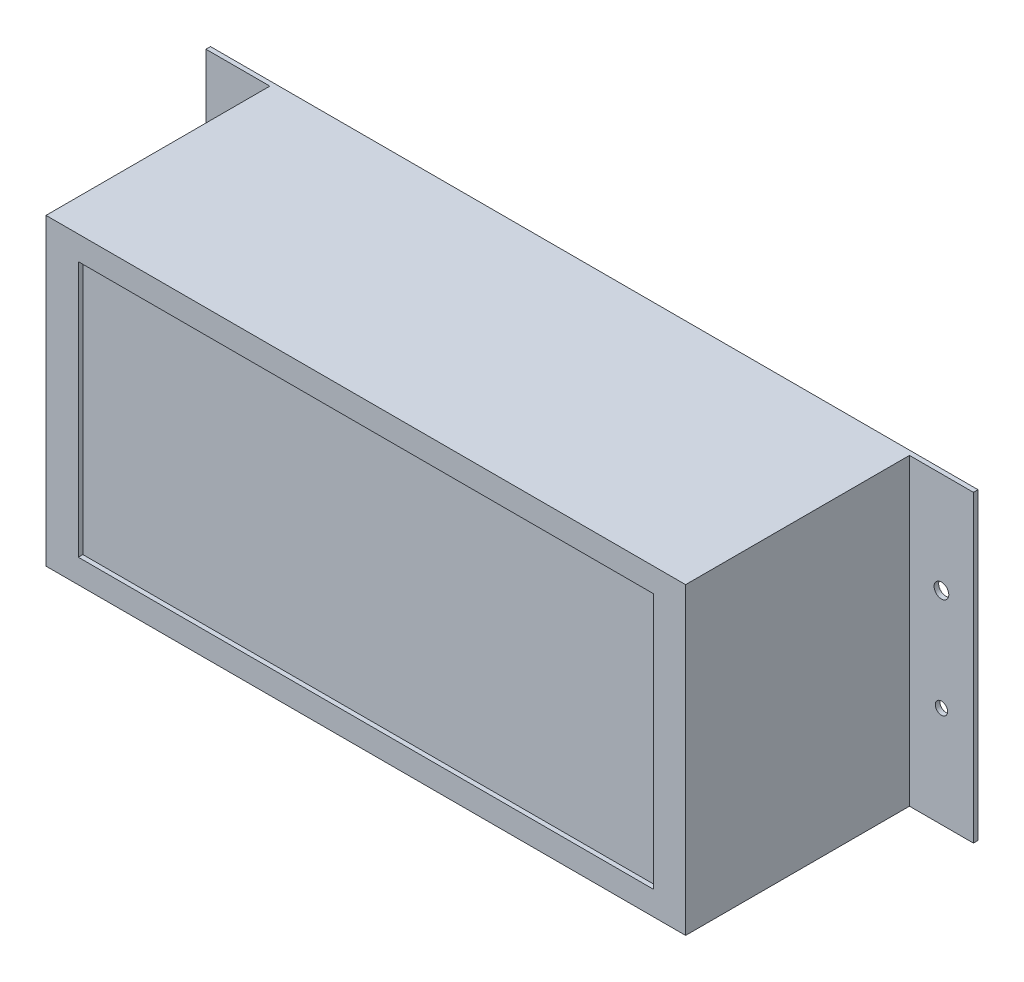
from build123d import *

# Parameters (mm, degrees)
CROQUIS1_W              = 280
CROQUIS1_H              = 133
SALIENTE_EXTRUIR1_DEPTH = 100
CROQUIS2_W              = 28
CROQUIS2_H              = 133
CROQUIS2_R              = 3.219169786
CROQUIS2_R_2            = 2.685008238
SALIENTE_EXTRUIR2_DEPTH = 2
CROQUIS5_W              = 251.717283082
CROQUIS5_H              = 112.065913702
CORTAR_EXTRUIR5_DEPTH   = 2
SALIENTE_EXTRUIR3_DEPTH = 2
CROQUIS8_W              = 280
CROQUIS8_H              = 113
CORTAR_EXTRUIR8_DEPTH   = 1


with BuildPart() as part:
    # Croquis1 → Saliente-Extruir1 (new body)
    with BuildSketch(Plane.XY):
        Rectangle(CROQUIS1_W, CROQUIS1_H)
    extrude(amount=SALIENTE_EXTRUIR1_DEPTH)

    # Croquis2 → Saliente-Extruir2 (add)
    # profile 1 of 2: a face of its own
    with BuildSketch(Plane(origin=(0, 0, 0), x_dir=(-1, 0, 0), z_dir=(0, 0, -1))):
        with Locations((-154, 0)):
            Rectangle(CROQUIS2_W, CROQUIS2_H)
        with Locations((-154, 22.27)):
            Circle(CROQUIS2_R, mode=Mode.SUBTRACT)
        with Locations((-154, -22.32)):
            Circle(CROQUIS2_R_2, mode=Mode.SUBTRACT)
    # profile 2 of 2: a face of its own
    with BuildSketch(Plane(origin=(0, 0, 0), x_dir=(-1, 0, 0), z_dir=(0, 0, -1))):
        with Locations((154, 0)):
            Rectangle(CROQUIS2_W, CROQUIS2_H)
        with Locations(Location((154, -22.32, 0), (0, 0, 180))):
            Circle(CROQUIS2_R_2, mode=Mode.SUBTRACT)
        with Locations(Location((154, 22.27, 0), (0, 0, 180))):
            Circle(CROQUIS2_R, mode=Mode.SUBTRACT)
    extrude(amount=-SALIENTE_EXTRUIR2_DEPTH)

    # Croquis5 → Cortar-Extruir5 (cut)
    with BuildSketch(Plane.XY.offset(100)):
        Rectangle(CROQUIS5_W, CROQUIS5_H)
    extrude(amount=-CORTAR_EXTRUIR5_DEPTH, mode=Mode.SUBTRACT)

    # Croquis6 → Saliente-Extruir3 (add)
    # profile 1 of 5: a face of its own
    with BuildSketch(Plane.XZ.offset(66.5)):
        with BuildLine():
            Line((69.930951795, 35.067554065), (73.153441111, 38.385446026))
            add(Edge.make_bspline(
                [(73.153441111, 38.385446026), (73.431442393, 38.063141885), (73.967396138, 37.441777445), (74.818171206, 36.61211083), (75.665378537, 35.909558439), (76.504549719, 35.331478038), (77.337250779, 34.87652343), (78.170591397, 34.555193776), (79.002284769, 34.353464182), (79.558499221, 34.327622611), (79.831626207, 34.314933205)],
                knots=[0, 0, 0, 0, 1.265880991, 2.440469525, 3.530740057, 4.536711111, 5.468008477, 6.34654737, 7.188078389, 8, 8, 8, 8], degree=3))
            add(Edge.make_bspline(
                [(79.831626207, 34.314933205), (80.166222801, 34.331385066), (80.824661544, 34.363760001), (81.767418959, 34.679081533), (82.631925953, 35.176872503), (83.396994708, 35.855596851), (84.035764688, 36.659911985), (84.514536587, 37.551668499), (84.801034986, 38.516562484), (84.837613321, 39.182115791), (84.85616547, 39.519677463)],
                knots=[0, 0, 0, 0, 0.999905305, 1.967672129, 2.944835807, 3.972828834, 5.013019963, 6.007753697, 6.989553527, 8, 8, 8, 8], degree=3))
            add(Edge.make_bspline(
                [(84.85616547, 39.519677463), (84.839371046, 39.825264321), (84.805829543, 40.435576591), (84.545076178, 41.335886151), (84.129815325, 42.213653276), (83.741706435, 42.75133055), (83.541729038, 43.028374712)],
                knots=[0, 0, 0, 0, 0.960159726, 1.917612774, 2.927026955, 4, 4, 4, 4], degree=3))
            add(Edge.make_bspline(
                [(83.541729038, 43.028374712), (83.42070926, 43.17565306), (83.161574277, 43.491014505), (82.69155011, 43.93981677), (82.134758735, 44.409101119), (81.485913926, 44.895683782), (80.743711514, 45.400074486), (79.919028431, 45.930841302), (79.001672203, 46.472447385), (78.355617997, 46.828536443), (78.018975967, 47.014085182)],
                knots=[0, 0, 0, 0, 0.667332049, 1.428932371, 2.272176193, 3.217953793, 4.268659351, 5.415594948, 6.6533338, 8, 8, 8, 8], degree=3))
            add(Edge.make_bspline(
                [(78.018975967, 47.014085182), (77.607458959, 47.244476669), (76.812543604, 47.689517158), (75.684251107, 48.381908705), (74.654216022, 49.065470471), (73.736660447, 49.755831292), (72.910069493, 50.424593515), (72.187725658, 51.090244696), (71.567391702, 51.754544222), (71.220426205, 52.219293712), (71.054582938, 52.441435609)],
                knots=[0, 0, 0, 0, 1.271974443, 2.457035787, 3.569878245, 4.604907449, 5.553098313, 6.436573686, 7.252710343, 8, 8, 8, 8], degree=3))
            add(Edge.make_bspline(
                [(71.054582938, 52.441435609), (70.777469881, 52.889327407), (70.224902616, 53.782429845), (69.676811744, 55.261275251), (69.316545392, 56.812643958), (69.274146731, 57.877278299), (69.252532991, 58.420001314)],
                knots=[0, 0, 0, 0, 0.995678878, 1.985397446, 2.973007791, 4, 4, 4, 4], degree=3))
            add(Edge.make_bspline(
                [(69.252532991, 58.420001314), (69.263387571, 58.802058445), (69.284777707, 59.554943758), (69.43416796, 60.663528547), (69.68924029, 61.724513847), (70.042550869, 62.744312691), (70.496469182, 63.720177517), (71.062301604, 64.645197893), (71.729930658, 65.519190074), (72.473352709, 66.353615), (73.303603217, 67.111776884), (74.199908569, 67.768294079), (75.135229654, 68.339447467), (76.130126058, 68.793638037), (77.172097942, 69.158656555), (78.26707811, 69.410267752), (79.410461009, 69.561130905), (80.188037891, 69.58205119), (80.584247067, 69.592710983)],
                knots=[0, 0, 0, 0, 1.032810722, 2.035266353, 3.017676364, 3.978389067, 4.948507077, 5.921677479, 6.903715858, 7.918386526, 8.939467451, 9.936812204, 10.918153393, 11.89693397, 12.887853058, 13.89815236, 14.929017384, 16, 16, 16, 16], degree=3))
            add(Edge.make_bspline(
                [(80.584247067, 69.592710983), (81.118991613, 69.577770278), (82.181050474, 69.548096469), (83.751372484, 69.26729927), (85.289053759, 68.835415133), (86.772000477, 68.219667024), (88.177558236, 67.462661169), (89.471172106, 66.56700031), (90.639382911, 65.537418905), (91.30669664, 64.749916864), (91.640353504, 64.356165844)],
                knots=[0, 0, 0, 0, 1.014105853, 2.01412079, 3.018242674, 4.040740662, 5.055023907, 6.042888753, 7.021444376, 8, 8, 8, 8], degree=3))
            Line((91.640353504, 64.356165844), (88.492066245, 60.773266538))
            add(Edge.make_bspline(
                [(88.492066245, 60.773266538), (88.193126191, 61.09613024), (87.613585697, 61.722050344), (86.686769681, 62.555477876), (85.743652546, 63.253997094), (84.793651927, 63.838248723), (83.822705263, 64.288424461), (82.836253714, 64.604693678), (81.836303732, 64.807957061), (81.164683345, 64.831819186), (80.828053825, 64.843779359)],
                knots=[0, 0, 0, 0, 1.179806542, 2.287233372, 3.337373186, 4.324005949, 5.273901747, 6.200048787, 7.097828587, 8, 8, 8, 8], degree=3))
            add(Edge.make_bspline(
                [(80.828053825, 64.843779359), (80.369679048, 64.823051946), (79.474091624, 64.782554059), (78.191287124, 64.414928756), (77.007060275, 63.838342924), (75.97793191, 63.0210043), (75.107023829, 62.070091103), (74.463687256, 61.002860793), (74.073871619, 59.838391047), (74.02581407, 59.030661517), (74.001464615, 58.621406896)],
                knots=[0, 0, 0, 0, 1.072236613, 2.094970478, 3.102399718, 4.141104368, 5.155589565, 6.110053346, 7.042415349, 8, 8, 8, 8], degree=3))
            add(Edge.make_bspline(
                [(74.001464615, 58.621406896), (74.01738128, 58.283956432), (74.048644905, 57.621133851), (74.309482211, 56.659500305), (74.703996697, 55.742090771), (75.103045019, 55.204818523), (75.305300753, 54.932504653)],
                knots=[0, 0, 0, 0, 1.014054094, 1.991812201, 2.982159616, 4, 4, 4, 4], degree=3))
            add(Edge.make_bspline(
                [(75.305300753, 54.932504653), (75.426565468, 54.795861122), (75.690723813, 54.498202162), (76.175883104, 54.069176396), (76.75216789, 53.603792256), (77.445174239, 53.130203184), (78.219937831, 52.605559948), (79.117839004, 52.085283002), (80.104076893, 51.517849386), (80.802286332, 51.142829391), (81.167263226, 50.946794183)],
                knots=[0, 0, 0, 0, 0.615029206, 1.339755737, 2.178261527, 3.109653826, 4.166232585, 5.329982127, 6.604294388, 8, 8, 8, 8], degree=3))
            add(Edge.make_bspline(
                [(81.167263226, 50.946794183), (81.561063617, 50.726976359), (82.324768252, 50.300679446), (83.406495151, 49.636710137), (84.382389673, 48.961383484), (85.275934074, 48.312582224), (86.064558803, 47.656098905), (86.745157069, 46.991204746), (87.344524737, 46.34471448), (87.6763487, 45.88664821), (87.834848029, 45.667847869)],
                knots=[0, 0, 0, 0, 1.262093308, 2.447601706, 3.550203992, 4.582594899, 5.537233252, 6.418365656, 7.244515135, 8, 8, 8, 8], degree=3))
            add(Edge.make_bspline(
                [(87.834848029, 45.667847869), (88.108568161, 45.227056277), (88.654357914, 44.348131034), (89.193712397, 42.879277801), (89.554221464, 41.32872995), (89.587922078, 40.256784024), (89.605097094, 39.710482751)],
                knots=[0, 0, 0, 0, 0.984940175, 1.963941237, 2.962352981, 4, 4, 4, 4], degree=3))
            add(Edge.make_bspline(
                [(89.605097094, 39.710482751), (89.597030113, 39.353285337), (89.581241888, 38.65419939), (89.454953384, 37.627084017), (89.225759624, 36.650977105), (88.934936006, 35.709312403), (88.539187279, 34.819401562), (88.059402709, 33.971990327), (87.484874398, 33.180811356), (86.83839996, 32.440440726), (86.135969753, 31.760499032), (85.365896696, 31.178866528), (84.560270476, 30.674454643), (83.701468161, 30.270467743), (82.800459046, 29.949405534), (81.850224845, 29.731934867), (80.857336317, 29.585653161), (80.178453483, 29.572646445), (79.831626207, 29.566001581)],
                knots=[0, 0, 0, 0, 1.087410352, 2.12821612, 3.143409386, 4.13688077, 5.124334423, 6.102425883, 7.096654197, 8.095527921, 9.09231389, 10.067027194, 11.028349958, 11.981147348, 12.950860869, 13.934615631, 14.944837612, 16, 16, 16, 16], degree=3))
            add(Edge.make_bspline(
                [(79.831626207, 29.566001581), (79.420487929, 29.582659075), (78.590498846, 29.616286539), (77.34569004, 29.884589403), (76.10412504, 30.321526808), (74.864531347, 30.93916471), (73.621627752, 31.716009213), (72.380985413, 32.672198922), (71.122447741, 33.780743135), (70.336991232, 34.629033072), (69.930951795, 35.067554065)],
                knots=[0, 0, 0, 0, 0.845753203, 1.707371858, 2.609134499, 3.549244224, 4.552329203, 5.621587647, 6.770486714, 8, 8, 8, 8], degree=3))
        make_face()
    # profile 2 of 5: a face of its own
    with BuildSketch(Plane.XZ.offset(66.5)):
        with BuildLine():
            Line((28.017390096, 56.702753718), (23.798473162, 58.918215123))
            add(Edge.make_bspline(
                [(23.798473162, 58.918215123), (24.134894122, 59.51437052), (24.789436084, 60.67425284), (25.909649487, 62.26868343), (27.096134829, 63.689601548), (28.372470958, 64.93033668), (29.722646607, 66.020035737), (31.166768654, 66.953747188), (32.680807799, 67.764428356), (34.286724753, 68.425177732), (35.982987247, 68.945259545), (37.780045253, 69.32917633), (39.686214617, 69.551851349), (40.991563529, 69.578874012), (41.659968221, 69.592710983)],
                knots=[0, 0, 0, 0, 1.120547187, 2.180141081, 3.186367408, 4.148075574, 5.090720713, 6.023293347, 6.960451315, 7.899733127, 8.862572377, 9.862522039, 10.90550313, 12, 12, 12, 12], degree=3))
            add(Edge.make_bspline(
                [(41.659968221, 69.592710983), (42.402948115, 69.575366783), (43.852286645, 69.541533273), (45.96199479, 69.24984961), (47.948326246, 68.774017428), (49.811170666, 68.109300641), (51.545961321, 67.241053009), (53.156163685, 66.183336671), (54.650179626, 64.941558535), (55.981178182, 63.505063682), (57.178690138, 61.967494541), (58.23799864, 60.366391113), (59.113356681, 58.702428534), (59.860509414, 57.000870119), (60.413336098, 55.239069736), (60.826072558, 53.432549741), (61.057330888, 51.574694645), (61.093353927, 50.318436833), (61.11150735, 49.68535922)],
                knots=[0, 0, 0, 0, 1.145213001, 2.233978795, 3.276616913, 4.289988888, 5.2768102, 6.260573508, 7.254647871, 8.264498533, 9.273731702, 10.25749501, 11.220258744, 12.169609138, 13.119022067, 14.062790212, 15.023763961, 16, 16, 16, 16], degree=3))
            add(Edge.make_bspline(
                [(61.11150735, 49.68535922), (61.095494142, 49.091258808), (61.063758078, 47.913830247), (60.863721173, 46.17112499), (60.509205314, 44.477361481), (60.02272994, 42.831132328), (59.39451467, 41.235193873), (58.625979927, 39.688574816), (57.715928501, 38.192920916), (57.013305934, 37.249444966), (56.659383953, 36.774201368)],
                knots=[0, 0, 0, 0, 1.024358464, 2.0301432, 3.019427413, 4.004406732, 4.986367066, 5.972626655, 6.978780325, 8, 8, 8, 8], degree=3))
            add(Edge.make_bspline(
                [(56.659383953, 36.774201368), (56.180820448, 36.200710809), (55.240390334, 35.073738558), (53.63328455, 33.606437654), (51.91652002, 32.351287162), (50.072828148, 31.327332909), (48.105314532, 30.539750194), (46.024127455, 29.979553025), (43.823514572, 29.630972758), (42.314970366, 29.587987906), (41.543364989, 29.566001581)],
                knots=[0, 0, 0, 0, 1.030811313, 2.025658015, 2.997072178, 3.962767568, 4.930766827, 5.917075773, 6.934604948, 8, 8, 8, 8], degree=3))
            add(Edge.make_bspline(
                [(41.543364989, 29.566001581), (40.750361552, 29.586370979), (39.194669575, 29.626331094), (36.926971016, 30.000106482), (34.777013624, 30.585648083), (32.762539902, 31.438754398), (30.852509773, 32.496237945), (29.09088237, 33.832847633), (27.429299872, 35.379933614), (26.463164233, 36.570948782), (25.971533392, 37.177012532)],
                knots=[0, 0, 0, 0, 1.056389096, 2.072394598, 3.055233004, 4.020130009, 4.981825462, 5.957811105, 6.960805292, 8, 8, 8, 8], degree=3))
            add(Edge.make_bspline(
                [(25.971533392, 37.177012532), (25.636995158, 37.633661917), (24.970145477, 38.543921093), (24.13486194, 40.028175492), (23.409791802, 41.581061859), (22.830233939, 43.227681827), (22.360946242, 44.948525479), (22.02142053, 46.755894905), (21.82230844, 48.649251898), (21.783169801, 49.939308154), (21.763216752, 50.596984487)],
                knots=[0, 0, 0, 0, 0.94817472, 1.890038105, 2.849395472, 3.817997239, 4.812318967, 5.836947057, 6.897266129, 8, 8, 8, 8], degree=3))
            Line((21.763216752, 50.596984487), (56.362575726, 50.596984487))
            add(Edge.make_bspline(
                [(56.362575726, 50.596984487), (56.339276239, 51.106493106), (56.293458736, 52.108421255), (56.080365402, 53.574673617), (55.742846607, 54.97073979), (55.27368568, 56.290671471), (54.685406286, 57.538802442), (53.987429506, 58.723734671), (53.149636056, 59.827472718), (52.216721362, 60.86431963), (51.177793282, 61.78732907), (50.085191019, 62.614105748), (48.924573936, 63.303226469), (47.707642063, 63.871008926), (46.428084315, 64.308012346), (45.087700078, 64.60894775), (43.690659036, 64.809987745), (42.738384324, 64.832379696), (42.253584674, 64.843779359)],
                knots=[0, 0, 0, 0, 1.094405546, 2.152104367, 3.174987145, 4.173015398, 5.153654967, 6.133208507, 7.119289451, 8.123438607, 9.122504012, 10.097966803, 11.060604936, 12.014205423, 12.976096155, 13.956823727, 14.959826266, 16, 16, 16, 16], degree=3))
            add(Edge.make_bspline(
                [(42.253584674, 64.843779359), (41.779552408, 64.834724145), (40.838981458, 64.816756862), (39.435384929, 64.636907866), (38.051295555, 64.356595127), (36.704660775, 63.949863034), (35.417046458, 63.468842397), (34.214595009, 62.906416299), (33.108597662, 62.27249209), (32.076868208, 61.540881921), (31.081577394, 60.652312387), (30.091089209, 59.541371081), (29.038550658, 58.219633199), (28.370586031, 57.227407417), (28.017390096, 56.702753718)],
                knots=[0, 0, 0, 0, 0.991026944, 1.966387566, 2.954903586, 3.941705208, 4.905318989, 5.827751054, 6.715113263, 7.568237245, 8.468614997, 9.499196909, 10.677664282, 12, 12, 12, 12], degree=3))
        make_face()
        with BuildLine():
            add(Edge.make_bspline(
                [(26.512148376, 45.848052863), (26.684967127, 45.217684682), (27.016722984, 44.007582566), (27.727718091, 42.336388861), (28.491314545, 40.834042367), (29.429032058, 39.538532524), (30.490241643, 38.394078701), (31.719801753, 37.399978682), (33.077091545, 36.488132027), (34.586786455, 35.727993967), (36.190537602, 35.103563095), (37.855047875, 34.644357991), (39.566466638, 34.374436061), (40.719145416, 34.334860727), (41.299558232, 34.314933205)],
                knots=[0, 0, 0, 0, 1.154958961, 2.217145986, 3.207012531, 4.129872728, 5.036522214, 5.960144231, 6.920619777, 7.92424629, 8.943461387, 9.961007416, 10.973298156, 12, 12, 12, 12], degree=3))
            add(Edge.make_bspline(
                [(41.299558232, 34.314933205), (41.773554687, 34.324112804), (42.710546028, 34.34225894), (44.090601775, 34.516663087), (45.421779568, 34.800627879), (46.697697793, 35.206918967), (47.92123849, 35.717805401), (49.098015423, 36.332653333), (50.213864346, 37.080763557), (50.911427838, 37.651765538), (51.263834407, 37.940233686)],
                knots=[0, 0, 0, 0, 1.04879286, 2.073242986, 3.073461291, 4.057960153, 5.032623303, 6.005244481, 6.992256684, 8, 8, 8, 8], degree=3))
            add(Edge.make_bspline(
                [(51.263834407, 37.940233686), (51.516260487, 38.168421376), (52.027109351, 38.630217648), (52.708973675, 39.426295505), (53.366703499, 40.285216902), (53.951192286, 41.244474551), (54.506662111, 42.27625102), (55.012839141, 43.388074927), (55.473078737, 44.584639308), (55.73143911, 45.41885865), (55.864361918, 45.848052863)],
                knots=[0, 0, 0, 0, 0.879905587, 1.780714457, 2.708106151, 3.677566983, 4.684151534, 5.740052498, 6.837288539, 8, 8, 8, 8], degree=3))
            Line((55.864361918, 45.848052863), (26.512148376, 45.848052863))
        make_face(mode=Mode.SUBTRACT)
    # profile 3 of 5: a face of its own
    with BuildSketch(Plane.XZ.offset(66.5)):
        with BuildLine():
            Line((-27.082937094, 14.640787906), (-27.082937094, 68.91429218))
            Line((-27.082937094, 68.91429218), (-22.33400547, 68.91429218))
            Line((-22.33400547, 68.91429218), (-22.33400547, 62.22550679))
            add(Edge.make_bspline(
                [(-22.33400547, 62.22550679), (-21.797781608, 62.830032647), (-20.749777818, 64.011526859), (-19.016181022, 65.564572852), (-17.163388002, 66.83255846), (-15.222964549, 67.861784863), (-13.17989113, 68.637635198), (-11.046166609, 69.18421215), (-8.823460473, 69.539768219), (-7.307695352, 69.574905068), (-6.539567703, 69.592710983)],
                knots=[0, 0, 0, 0, 1.074235403, 2.099501444, 3.086304576, 4.053325556, 5.01427503, 5.985443889, 6.979105517, 8, 8, 8, 8], degree=3))
            add(Edge.make_bspline(
                [(-6.539567703, 69.592710983), (-5.856669402, 69.574172479), (-4.509963716, 69.537613729), (-2.528955545, 69.253901323), (-0.622462289, 68.798518387), (1.210731096, 68.164415558), (2.958203222, 67.327640061), (4.629800632, 66.315026133), (6.229424536, 65.120975438), (7.726653436, 63.750605586), (9.107135583, 62.263763289), (10.314918031, 60.673293314), (11.33855298, 59.001040726), (12.179797577, 57.247475524), (12.830796756, 55.413879563), (13.283716038, 53.501510729), (13.567122709, 51.5135511), (13.603662939, 50.159793013), (13.622191111, 49.473353344)],
                knots=[0, 0, 0, 0, 1.034036272, 2.039165313, 3.024406509, 3.999331371, 4.971254918, 5.953351348, 6.95522652, 7.989525907, 9.023492927, 10.024309745, 11.009187477, 11.988246066, 12.964946762, 13.950187958, 14.960617622, 16, 16, 16, 16], degree=3))
            add(Edge.make_bspline(
                [(13.622191111, 49.473353344), (13.603251992, 48.801101627), (13.565810374, 47.472096248), (13.286748581, 45.517566865), (12.817835464, 43.63481648), (12.158521481, 41.830819499), (11.316829539, 40.09831063), (10.275590384, 38.450845052), (9.068243162, 36.863221181), (7.673007152, 35.386351297), (6.162340075, 34.027099426), (4.553766434, 32.830146953), (2.867343532, 31.820129276), (1.099689853, 30.999083098), (-0.736678054, 30.346629823), (-2.65571009, 29.891807068), (-4.648679276, 29.624444095), (-6.001676068, 29.585669602), (-6.687971816, 29.566001581)],
                knots=[0, 0, 0, 0, 1.02050356, 2.017480486, 2.990790918, 3.96161403, 4.928589988, 5.909588639, 6.91611943, 7.952353252, 8.989586576, 9.99823133, 10.991940466, 11.968822692, 12.952985106, 13.945868367, 14.958059758, 16, 16, 16, 16], degree=3))
            add(Edge.make_bspline(
                [(-6.687971816, 29.566001581), (-7.477559927, 29.58928196), (-9.02743364, 29.634978758), (-11.294398081, 30.029899078), (-13.446512694, 30.662031401), (-15.483694828, 31.559943394), (-17.38806289, 32.730136927), (-19.185074275, 34.137419297), (-20.8471948, 35.817169943), (-21.830845797, 37.081496339), (-22.33400547, 37.72822781)],
                knots=[0, 0, 0, 0, 1.03083325, 2.023411113, 2.996083796, 3.9549903, 4.922369457, 5.908572979, 6.930187902, 8, 8, 8, 8], degree=3))
            Line((-22.33400547, 37.72822781), (-22.33400547, 14.640787906))
            Line((-22.33400547, 14.640787906), (-27.082937094, 14.640787906))
        make_face()
        with BuildLine():
            add(Edge.make_bspline(
                [(-6.751573579, 34.314933205), (-6.05740704, 34.339653123), (-4.687232703, 34.38844631), (-2.675524095, 34.768743742), (-0.751455665, 35.403133148), (1.0818437, 36.265734262), (2.773759925, 37.370699674), (4.310944491, 38.673539574), (5.65172696, 40.190216241), (6.78539626, 41.885883787), (7.726551884, 43.692823549), (8.376022361, 45.595476375), (8.807403594, 47.542417406), (8.851250365, 48.863320442), (8.873259487, 49.526354813)],
                knots=[0, 0, 0, 0, 1.031179624, 2.035384561, 3.030098214, 4.035455833, 5.037557836, 6.024646278, 7.02156144, 8.035264006, 9.049836703, 10.039645228, 11.015989397, 12, 12, 12, 12], degree=3))
            add(Edge.make_bspline(
                [(8.873259487, 49.526354813), (8.844688932, 50.185264772), (8.787659809, 51.500501985), (8.389275026, 53.450426628), (7.689994262, 55.340666141), (6.769426016, 57.170898216), (5.617911301, 58.879213602), (4.279775148, 60.423894896), (2.734790602, 61.746818025), (1.02797602, 62.854906553), (-0.793058784, 63.74627474), (-2.708773725, 64.374959548), (-4.68577849, 64.771905625), (-6.03243904, 64.81974086), (-6.709172404, 64.843779359)],
                knots=[0, 0, 0, 0, 0.979235476, 1.954632679, 2.943119654, 3.967171814, 4.992637064, 5.997548408, 6.995574264, 8.005058949, 9.015076297, 9.999929117, 10.994910263, 12, 12, 12, 12], degree=3))
            add(Edge.make_bspline(
                [(-6.709172404, 64.843779359), (-7.396269305, 64.818769814), (-8.759361318, 64.769154815), (-10.778025841, 64.386234663), (-12.733408309, 63.743968115), (-14.609584344, 62.869390775), (-16.354431869, 61.785127602), (-17.913171635, 60.510131086), (-19.259772871, 59.050021767), (-20.368477062, 57.41352418), (-21.254316734, 55.639222347), (-21.881558417, 53.744095714), (-22.262522926, 51.739405803), (-22.309848492, 50.365472514), (-22.33400547, 49.664158632)],
                knots=[0, 0, 0, 0, 1.017730373, 2.019016736, 3.032373701, 4.060729657, 5.079187105, 6.068726676, 7.03591854, 8.011858086, 8.988317194, 9.965225429, 10.961364673, 12, 12, 12, 12], degree=3))
            add(Edge.make_bspline(
                [(-22.33400547, 49.664158632), (-22.319496151, 49.129884496), (-22.290937218, 48.078263922), (-22.072764027, 46.534190174), (-21.725695406, 45.056560102), (-21.236695775, 43.643756386), (-20.594105707, 42.30382531), (-19.819900023, 41.026263675), (-18.898198612, 39.822971799), (-17.857051199, 38.695473538), (-16.704571096, 37.672226315), (-15.479057873, 36.770344798), (-14.183594905, 36.007104867), (-12.819091537, 35.396313286), (-11.396057272, 34.898716699), (-9.90085259, 34.570062755), (-8.348546422, 34.34367091), (-7.289502679, 34.3246133), (-6.751573579, 34.314933205)],
                knots=[0, 0, 0, 0, 1.050062701, 2.066855696, 3.059271411, 4.030305351, 4.999747758, 5.975466543, 6.961907836, 7.974539719, 8.98812422, 9.98710676, 10.961662635, 11.93785114, 12.922015094, 13.919620009, 14.94329489, 16, 16, 16, 16], degree=3))
        make_face(mode=Mode.SUBTRACT)
    # profile 4 of 5: a face of its own
    with BuildSketch(Plane.XZ.offset(66.5)):
        with BuildLine():
            Line((-37.937637949, 30.244420385), (-42.686569573, 30.244420385))
            Line((-42.686569573, 30.244420385), (-42.686569573, 37.399618702))
            add(Edge.make_bspline(
                [(-42.686569573, 37.399618702), (-43.192480357, 36.75559849), (-44.178737684, 35.500101132), (-45.852768963, 33.849918721), (-47.659803954, 32.496564443), (-49.569710057, 31.399403707), (-51.601297712, 30.584994804), (-53.731794434, 29.984935436), (-55.985155083, 29.630391503), (-57.525727345, 29.587748867), (-58.311402639, 29.566001581)],
                knots=[0, 0, 0, 0, 1.079470681, 2.104394496, 3.089609837, 4.049760214, 5.000876222, 5.968810619, 6.964115249, 8, 8, 8, 8], degree=3))
            add(Edge.make_bspline(
                [(-58.311402639, 29.566001581), (-58.997680449, 29.585855595), (-60.354144594, 29.625098097), (-62.350814841, 29.890785946), (-64.27358552, 30.346136772), (-66.111578717, 31.002317278), (-67.884484584, 31.813536883), (-69.566056807, 32.837353969), (-71.182487946, 34.022780901), (-72.693125567, 35.387005086), (-74.088936719, 36.863051495), (-75.296134933, 38.450888712), (-76.337412534, 40.098299245), (-77.179094398, 41.830822544), (-77.838411079, 43.634815662), (-78.307323467, 45.51756709), (-78.586385458, 47.472096189), (-78.623827048, 48.801101607), (-78.642766154, 49.473353344)],
                knots=[0, 0, 0, 0, 1.041296284, 2.058176809, 3.050446431, 4.034000596, 5.01514041, 6.003636468, 7.015969324, 8.052561599, 9.08815499, 10.094063707, 11.074456064, 12.040834395, 13.011057502, 13.983766392, 14.980127149, 16, 16, 16, 16], degree=3))
            add(Edge.make_bspline(
                [(-78.642766154, 49.473353344), (-78.624340974, 50.159832284), (-78.588003859, 51.51366782), (-78.303118611, 53.50106366), (-77.855363425, 55.416665581), (-77.1842136, 57.242243171), (-76.362499318, 59.004209499), (-75.334357898, 60.672787132), (-74.128013771, 62.263883063), (-72.747201901, 63.750657648), (-71.249800812, 65.120650494), (-69.648732684, 66.31803547), (-67.967886099, 67.327931946), (-66.215295793, 68.159728396), (-64.384838662, 68.800822381), (-62.477501755, 69.254664507), (-60.4928717, 69.537011856), (-59.142691726, 69.574002236), (-58.459806752, 69.592710983)],
                knots=[0, 0, 0, 0, 1.038787011, 2.048637893, 3.033314735, 4.011256821, 4.987456671, 5.971770257, 6.972013799, 8.005388554, 9.039095487, 10.040396776, 11.026510796, 12.002710647, 12.972028308, 13.95670515, 14.966556032, 16, 16, 16, 16], degree=3))
            add(Edge.make_bspline(
                [(-58.459806752, 69.592710983), (-57.687995814, 69.572177115), (-56.170952798, 69.531816503), (-53.944773242, 69.156395759), (-51.814453244, 68.55809945), (-49.7852156, 67.694179871), (-47.842904395, 66.614617483), (-46.015032441, 65.267108707), (-44.261473636, 63.713449376), (-43.218048641, 62.516948031), (-42.686569573, 61.907497975)],
                knots=[0, 0, 0, 0, 1.019216655, 2.003334536, 2.974394125, 3.93700843, 4.911195144, 5.904014639, 6.932388669, 8, 8, 8, 8], degree=3))
            Line((-42.686569573, 61.907497975), (-42.686569573, 83.161087051))
            Line((-42.686569573, 83.161087051), (-37.937637949, 83.161087051))
            Line((-37.937637949, 83.161087051), (-37.937637949, 30.244420385))
        make_face()
        with BuildLine():
            add(Edge.make_bspline(
                [(-58.269001464, 34.314933205), (-57.731079524, 34.324627717), (-56.672049877, 34.343713712), (-55.119641384, 34.569899518), (-53.624811775, 34.899308698), (-52.203449933, 35.39308394), (-50.84398997, 36.013588878), (-49.5440732, 36.763323895), (-48.325560503, 37.675973724), (-47.174015179, 38.698421428), (-46.121991083, 39.819394048), (-45.201158688, 41.026698554), (-44.426341275, 42.303710167), (-43.783913523, 43.643787185), (-43.294870238, 45.056551651), (-42.947813612, 46.534192508), (-42.729637144, 48.07826331), (-42.701078663, 49.12988429), (-42.686569573, 49.664158632)],
                knots=[0, 0, 0, 0, 1.056783697, 2.080534709, 3.078213817, 4.062450963, 5.032388505, 6.013014931, 7.006476528, 8.020136409, 9.037574406, 10.02408906, 10.99988041, 11.969394914, 12.94050107, 13.932990591, 14.949859205, 16, 16, 16, 16], degree=3))
            add(Edge.make_bspline(
                [(-42.686569573, 49.664158632), (-42.711038125, 50.36536774), (-42.758974092, 51.73909577), (-43.135740809, 53.746378783), (-43.779863663, 55.637034676), (-44.661773174, 57.41381796), (-45.771595188, 59.05002285), (-47.118146158, 60.509836927), (-48.6782736, 61.788257872), (-50.43271839, 62.869312679), (-52.316337159, 63.741890255), (-54.274240421, 64.386515253), (-56.293042408, 64.769083679), (-57.656115937, 64.818745973), (-58.34320352, 64.843779359)],
                knots=[0, 0, 0, 0, 1.03769607, 2.032934487, 3.010626162, 3.986202239, 4.961259226, 5.927576439, 6.916221152, 7.938198981, 8.97036853, 9.982809098, 10.983189979, 12, 12, 12, 12], degree=3))
            add(Edge.make_bspline(
                [(-58.34320352, 64.843779359), (-59.016540858, 64.820247546), (-60.352994424, 64.773541127), (-62.320876866, 64.369298121), (-64.233235132, 63.751710786), (-66.050472013, 62.85141514), (-67.755405068, 61.747170432), (-69.300927034, 60.424217987), (-70.637394786, 58.876037211), (-71.801315546, 57.174066052), (-72.723584357, 55.342584847), (-73.406956913, 53.448180368), (-73.809017969, 51.500769738), (-73.865525355, 50.18535414), (-73.89383453, 49.526354813)],
                knots=[0, 0, 0, 0, 1.001026069, 1.986856787, 2.977862212, 3.984342003, 4.995015878, 5.994217425, 7.000312571, 8.029930354, 9.055188864, 10.043064731, 11.019610969, 12, 12, 12, 12], degree=3))
            add(Edge.make_bspline(
                [(-73.89383453, 49.526354813), (-73.871746541, 48.863363163), (-73.827742651, 47.542545235), (-73.397538148, 45.594966793), (-72.74402837, 43.696302863), (-71.820515404, 41.879412206), (-70.670116614, 40.193946435), (-69.332439845, 38.672951436), (-67.794085263, 37.370859252), (-66.102486341, 36.265691062), (-64.269101467, 35.403144595), (-62.345055749, 34.768740674), (-60.333341097, 34.388447104), (-58.963167585, 34.33965339), (-58.269001464, 34.314933205)],
                knots=[0, 0, 0, 0, 0.983964174, 1.960262275, 2.950024098, 3.962167997, 4.978769863, 5.975637987, 6.962679854, 7.964734575, 8.970044757, 9.964711476, 10.968869031, 12, 12, 12, 12], degree=3))
        make_face(mode=Mode.SUBTRACT)
    # profile 5 of 5: a face of its own
    with BuildSketch(Plane.XZ.offset(66.5)):
        with BuildLine():
            Line((-126.132082393, 38.629252783), (-122.156972217, 41.099121239))
            add(Edge.make_bspline(
                [(-122.156972217, 41.099121239), (-121.721116436, 40.557384155), (-120.86320833, 39.491066681), (-119.373041626, 38.115738348), (-117.7841673, 36.929677919), (-116.066627279, 35.976034769), (-114.235469937, 35.223231716), (-112.286922752, 34.700043492), (-110.221586957, 34.371190506), (-108.805414781, 34.333992896), (-108.079782046, 34.314933205)],
                knots=[0, 0, 0, 0, 1.026629843, 2.020746545, 2.988156479, 3.951609825, 4.916760838, 5.907688704, 6.927920211, 8, 8, 8, 8], degree=3))
            add(Edge.make_bspline(
                [(-108.079782046, 34.314933205), (-107.499831834, 34.33091262), (-106.357635662, 34.362383644), (-104.680830486, 34.559076118), (-103.083654046, 34.916570695), (-101.555887204, 35.387363228), (-100.109153802, 36.019249487), (-98.739400773, 36.783568354), (-97.442046626, 37.683576553), (-96.237701016, 38.712790309), (-95.14012128, 39.843239135), (-94.169403681, 41.037041335), (-93.359210708, 42.302555351), (-92.683850142, 43.615762326), (-92.175721159, 44.999253911), (-91.802055603, 46.436222688), (-91.574291383, 47.936124254), (-91.546694503, 48.956687269), (-91.532723419, 49.473353344)],
                knots=[0, 0, 0, 0, 1.11253269, 2.191102883, 3.232049486, 4.248096668, 5.252846381, 6.25411548, 7.252444123, 8.276484619, 9.287796331, 10.271127345, 11.222403915, 12.165070373, 13.097940083, 14.043161362, 15.009338842, 16, 16, 16, 16], degree=3))
            add(Edge.make_bspline(
                [(-91.532723419, 49.473353344), (-91.559970913, 50.150154094), (-91.614238196, 51.498099648), (-92.02880688, 53.483935856), (-92.718064799, 55.404007871), (-93.667510081, 57.235907746), (-94.853157195, 58.93650393), (-96.236023506, 60.474350834), (-97.847501073, 61.785186191), (-99.640103588, 62.882265613), (-101.58151496, 63.767750453), (-103.656331209, 64.392583685), (-105.846887465, 64.771838455), (-107.34682538, 64.819485872), (-108.111582927, 64.843779359)],
                knots=[0, 0, 0, 0, 0.966432114, 1.924787868, 2.884432441, 3.8733594, 4.863432433, 5.839037063, 6.818291847, 7.820033371, 8.83442759, 9.858062464, 10.907912868, 12, 12, 12, 12], degree=3))
            add(Edge.make_bspline(
                [(-108.111582927, 64.843779359), (-108.812429167, 64.824132199), (-110.18977801, 64.785520316), (-112.203140534, 64.460022894), (-114.119932044, 63.927172719), (-115.940084411, 63.184107058), (-117.660271683, 62.22363152), (-119.269379447, 61.038915485), (-120.799426133, 59.664040694), (-121.698963755, 58.600899938), (-122.156972217, 58.059591325)],
                knots=[0, 0, 0, 0, 1.039848629, 2.043578496, 3.018386758, 3.987534228, 4.954977003, 5.934852016, 6.948509513, 8, 8, 8, 8], degree=3))
            Line((-122.156972217, 58.059591325), (-126.132082393, 60.6672636))
            add(Edge.make_bspline(
                [(-126.132082393, 60.6672636), (-125.896409165, 61.013346765), (-125.425844937, 61.704364399), (-124.639266856, 62.67874021), (-123.790675082, 63.590587696), (-122.884057746, 64.439634622), (-121.930920741, 65.240774156), (-120.906454274, 65.97130235), (-119.828098913, 66.64970496), (-118.690907162, 67.26448935), (-117.506078599, 67.815898501), (-116.273577074, 68.29309127), (-114.998970183, 68.696556655), (-113.685122068, 69.023025531), (-112.329959408, 69.281301185), (-110.934514178, 69.453075874), (-109.499047501, 69.581182116), (-108.528827077, 69.58883471), (-108.037380871, 69.592710983)],
                knots=[0, 0, 0, 0, 0.954067324, 1.904967979, 2.850944488, 3.791040077, 4.734579251, 5.686741025, 6.656553487, 7.63677735, 8.631289747, 9.633371755, 10.647134148, 11.676547777, 12.717490898, 13.789379914, 14.88025357, 16, 16, 16, 16], degree=3))
            add(Edge.make_bspline(
                [(-108.037380871, 69.592710983), (-107.287321373, 69.579213293), (-105.817199315, 69.552757722), (-103.665280065, 69.262659732), (-101.609385815, 68.823701153), (-99.645902734, 68.199020126), (-97.786838167, 67.374055784), (-96.016702794, 66.389436315), (-94.353810118, 65.212600534), (-92.808884253, 63.871589829), (-91.396560091, 62.415889367), (-90.165801879, 60.855039553), (-89.128429167, 59.218131891), (-88.250973975, 57.511939869), (-87.599824335, 55.714007967), (-87.132794402, 53.841915966), (-86.836159848, 51.896127298), (-86.801409341, 50.569784302), (-86.783791795, 49.897365096)],
                knots=[0, 0, 0, 0, 1.113059169, 2.18160405, 3.217886321, 4.231664885, 5.234757072, 6.233049254, 7.234521092, 8.253729116, 9.266692789, 10.241774134, 11.199466202, 12.140354715, 13.084805663, 14.031527209, 15.002038753, 16, 16, 16, 16], degree=3))
            add(Edge.make_bspline(
                [(-86.783791795, 49.897365096), (-86.790865184, 49.4411689), (-86.804935322, 48.533719369), (-86.951139101, 47.185040738), (-87.17011827, 45.860249196), (-87.480996894, 44.561246062), (-87.871098815, 43.284101914), (-88.361381993, 42.035637397), (-88.935152634, 40.808588314), (-89.60269264, 39.618063122), (-90.339033102, 38.471271156), (-91.139186393, 37.374741726), (-92.016910728, 36.356558641), (-92.953637583, 35.391239519), (-93.963558511, 34.507605036), (-95.027859048, 33.667479023), (-96.172802953, 32.914387613), (-97.36920976, 32.211151957), (-98.618625208, 31.586091497), (-99.912255638, 31.047282277), (-101.242641518, 30.586886763), (-102.611820559, 30.222377864), (-104.010729289, 29.916711038), (-105.450384929, 29.724428943), (-106.925281705, 29.588565156), (-107.923985847, 29.573585308), (-108.429591742, 29.566001581)],
                knots=[0, 0, 0, 0, 0.991083503, 1.971428668, 2.944771278, 3.907728914, 4.872032831, 5.84458753, 6.820199395, 7.813689706, 8.808455339, 9.780676499, 10.761021664, 11.727616056, 12.70141294, 13.675300653, 14.672050164, 15.67696011, 16.690052069, 17.705469636, 18.720567748, 19.746988726, 20.783187267, 21.830086354, 22.901455311, 24, 24, 24, 24], degree=3))
            add(Edge.make_bspline(
                [(-108.429591742, 29.566001581), (-109.062781647, 29.579934552), (-110.325996479, 29.607730851), (-112.199823934, 29.841829725), (-114.046232238, 30.19436682), (-115.831973634, 30.718141404), (-117.535479575, 31.346134031), (-119.122866323, 32.069188073), (-120.582550287, 32.871030989), (-121.91411163, 33.779016472), (-123.119856858, 34.808153755), (-124.231270582, 35.953365013), (-125.25619634, 37.221923476), (-125.837710833, 38.156271483), (-126.132082393, 38.629252783)],
                knots=[0, 0, 0, 0, 1.09515944, 2.184844758, 3.26271859, 4.344330843, 5.400469667, 6.401765382, 7.359563569, 8.278649927, 9.185124711, 10.097353643, 11.036851215, 12, 12, 12, 12], degree=3))
        make_face()
    extrude(amount=SALIENTE_EXTRUIR3_DEPTH)

    # Croquis8 → Cortar-Extruir8 (cut)
    with BuildSketch(Plane(origin=(0, 0, 0), x_dir=(-1, 0, 0), z_dir=(0, 0, -1))):
        Rectangle(CROQUIS8_W, CROQUIS8_H)
    extrude(amount=-CORTAR_EXTRUIR8_DEPTH, mode=Mode.SUBTRACT)


solid = part.part
